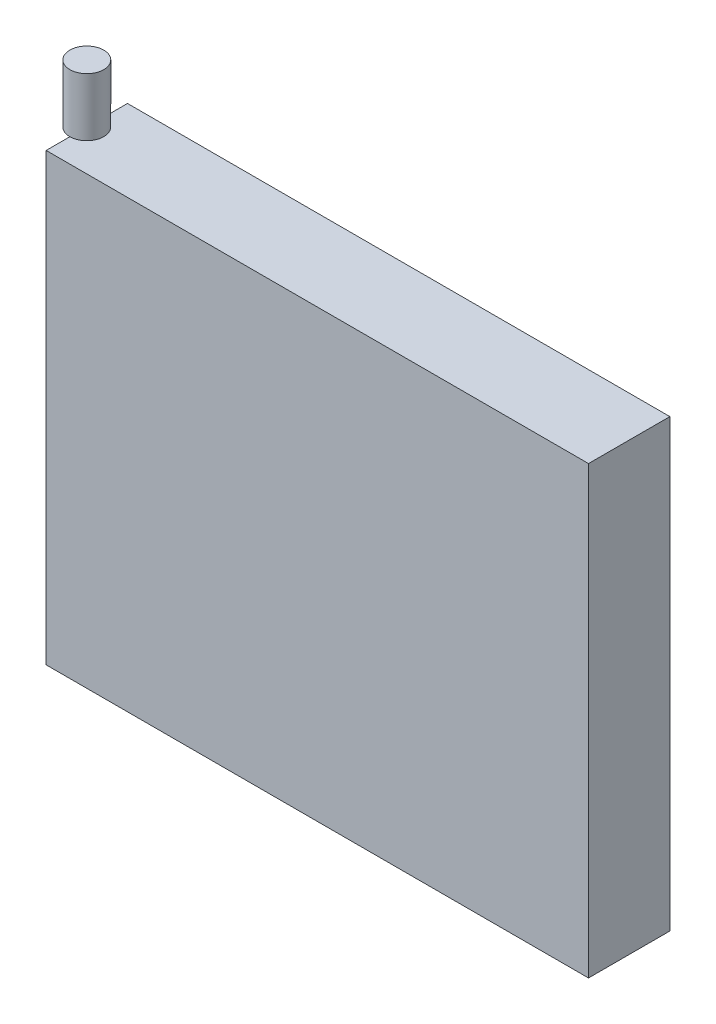
from build123d import *

# Parameters (mm, degrees)
SKETCH_1_W      = 140
SKETCH_1_H      = 115
EXTRUDE_1_DEPTH = 21
SKETCH_2_R      = 4.374107243
EXTRUDE_2_DEPTH = 15


with BuildPart() as part:
    # 草图1 → 凸台-拉伸1 (new body)
    with BuildSketch(Plane.XY):
        with Locations((70, 57.5)):
            Rectangle(SKETCH_1_W, SKETCH_1_H)
    extrude(amount=EXTRUDE_1_DEPTH)

    # 草图2 → 凸台-拉伸2 (add)
    with BuildSketch(Plane(origin=(0, 115, 0), x_dir=(1, 0, 0), z_dir=(0, 1, 0))):
        with Locations(Location((0, -10.5, 0), (0, 0, 270))):
            Circle(SKETCH_2_R)
    extrude(amount=EXTRUDE_2_DEPTH)


solid = part.part
